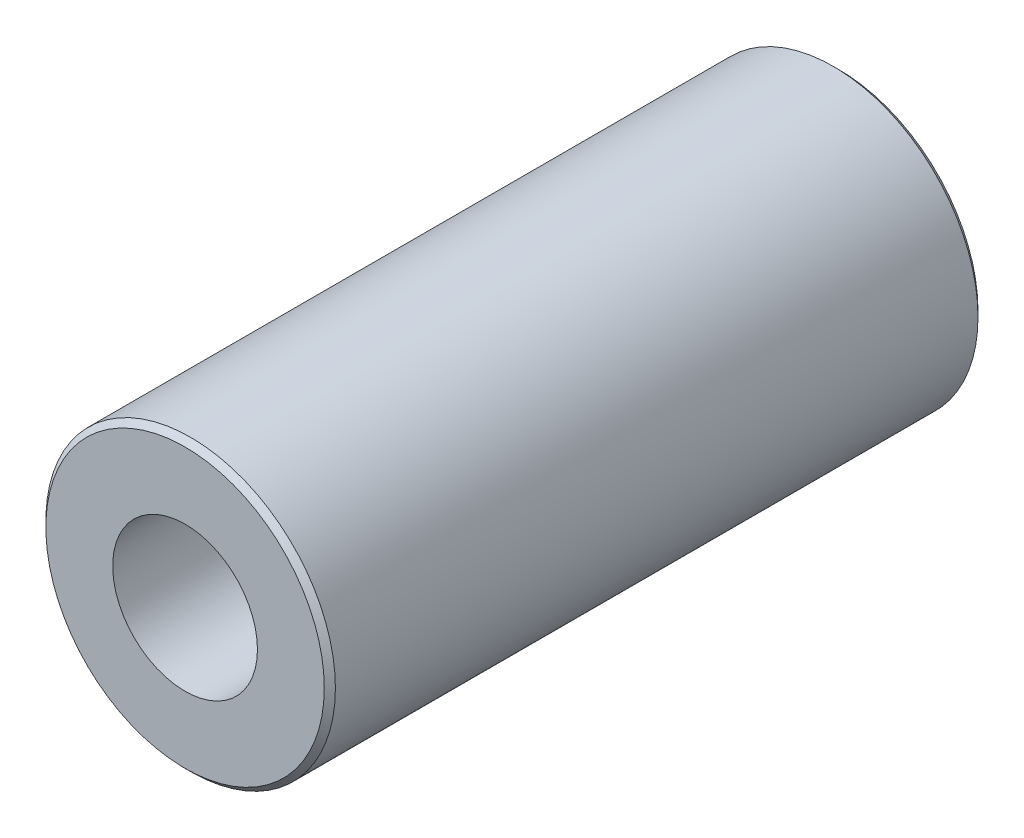
from build123d import *

# Parameters (mm, degrees)
SKETCH1_R           = 13
SKETCH1_R_2         = 6.5
BOSS_EXTRUDE1_DEPTH = 58.7
CHAMFER1_SIZE       = 0.5


with BuildPart() as part:
    # Sketch1 → Boss-Extrude1 (new body)
    with BuildSketch(Plane.XY):
        Circle(SKETCH1_R)
        Circle(SKETCH1_R_2, mode=Mode.SUBTRACT)
    extrude(amount=BOSS_EXTRUDE1_DEPTH)

    # Chamfer1
    chamfer1_edges = [part.edges().sort_by_distance(p)[0] for p in [
        (-13, 0, 0),
        (-13, 0, 58.7),
    ]]
    chamfer(chamfer1_edges, length=CHAMFER1_SIZE)


solid = part.part
